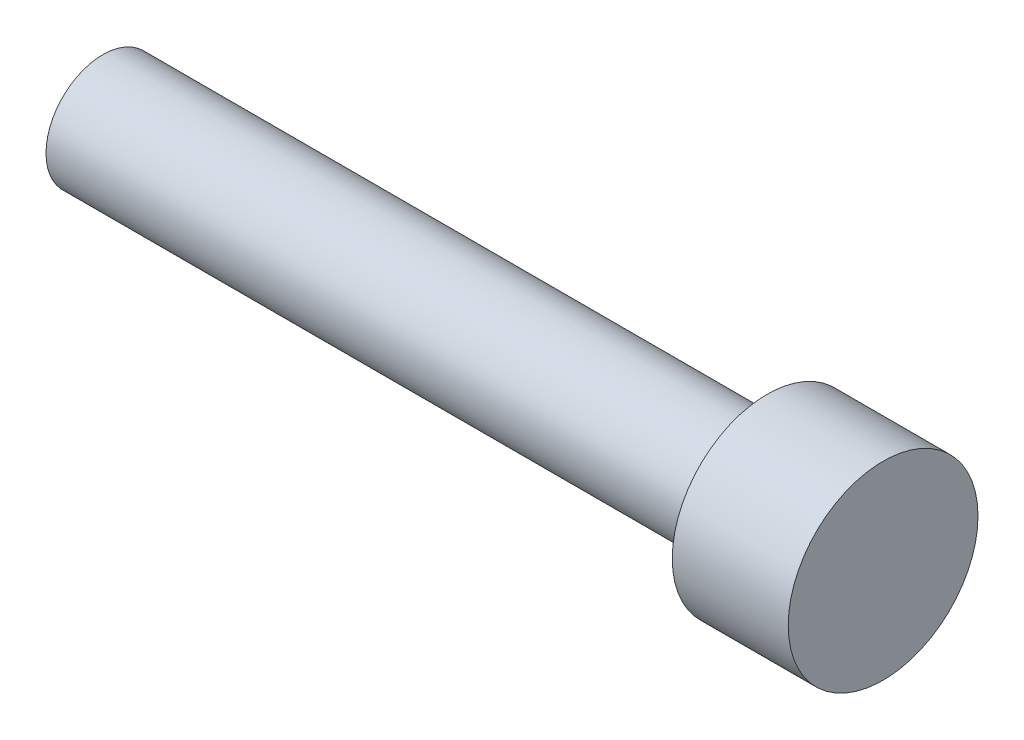
from build123d import *

# Parameters (mm, degrees)
SKETCH_1_W   = 28.89
SKETCH_1_H   = 3
SKETCH_1_W_2 = 6.11


with BuildPart() as part:
    # 스케치1 → 회전1 (revolve)
    with BuildSketch(Plane.XY, mode=Mode.PRIVATE) as revolve_1_sk:
        with Locations((-3.055, 1.5)):
            Rectangle(SKETCH_1_W, SKETCH_1_H)
        with Locations((14.445, 1.5)):
            Rectangle(SKETCH_1_W_2, SKETCH_1_H)
        Polygon((17.5, 3), (17.5, 0), (23.61, 0), (23.61, 5), (17.5, 5), align=None)
    revolve(revolve_1_sk.sketch.rotate(Axis((0, 0, 0), (1, 0, 0)), 90), axis=Axis((0, 0, 0), (1, 0, 0)))


solid = part.part
